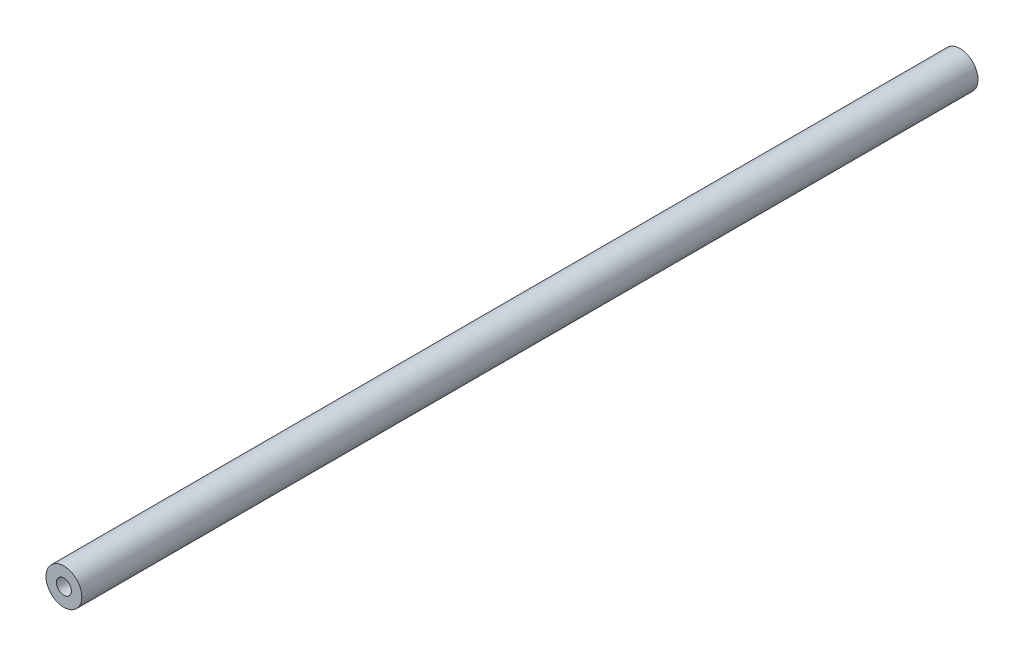
from build123d import *

# Parameters (mm, degrees)
SKETCH_1_R             = 6
EXTRUDE_1_DEPTH        = 150
HOLE_WIZARD_M6_1_D     = 5
HOLE_WIZARD_M6_1_DEPTH = 15
HOLE_WIZARD_M6_1_TIP   = 1.502151548
HOLE_WIZARD_M6_2_D     = 5
HOLE_WIZARD_M6_2_DEPTH = 15
HOLE_WIZARD_M6_2_TIP   = 1.502151548


with BuildPart() as part:
    # 草图1 → 凸台-拉伸1 (new, symmetric)
    with BuildSketch(Plane.XY):
        Circle(SKETCH_1_R)
    extrude(amount=EXTRUDE_1_DEPTH, both=True)

    # M6 螺纹孔1
    with Locations(Plane(origin=(0, 0, -150), x_dir=(-1, 0, 0), z_dir=(0, 0, -1))):
        with Locations((0, 0)):
            Hole(HOLE_WIZARD_M6_1_D / 2, depth=HOLE_WIZARD_M6_1_DEPTH)
            with Locations((0, 0, -(HOLE_WIZARD_M6_1_DEPTH + HOLE_WIZARD_M6_1_TIP / 2))):  # 118° drill point
                Cone(0, HOLE_WIZARD_M6_1_D / 2, HOLE_WIZARD_M6_1_TIP, mode=Mode.SUBTRACT)

    # M6 螺纹孔2
    with Locations(Plane.XY.offset(150)):
        with Locations((0, 0)):
            Hole(HOLE_WIZARD_M6_2_D / 2, depth=HOLE_WIZARD_M6_2_DEPTH)
            with Locations((0, 0, -(HOLE_WIZARD_M6_2_DEPTH + HOLE_WIZARD_M6_2_TIP / 2))):  # 118° drill point
                Cone(0, HOLE_WIZARD_M6_2_D / 2, HOLE_WIZARD_M6_2_TIP, mode=Mode.SUBTRACT)


solid = part.part
